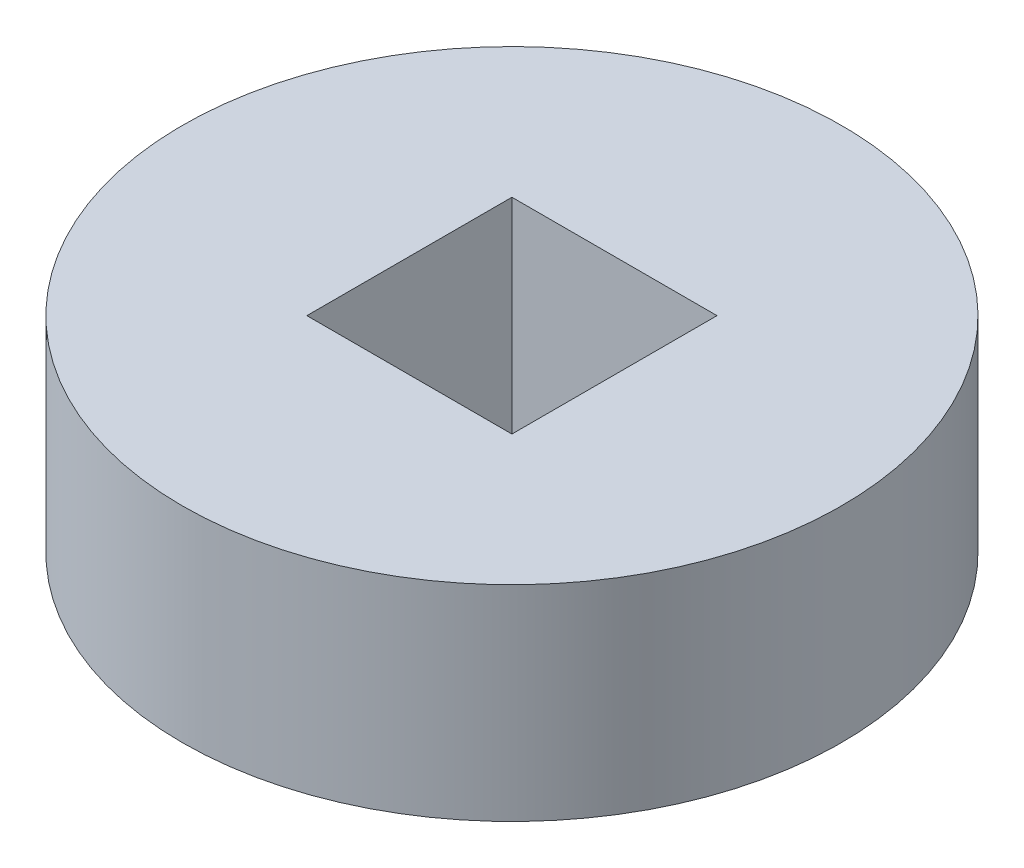
from build123d import *

# Parameters (mm, degrees)
ELEVATOR_SUPPORT_PULLEYS_R = 10.205128061
ELEVATOR_SUPPORT_PULLEYS_W = 6.35
ELEVATOR_SUPPORT_PULLEYS_H = 6.35
BOSS_EXTRUDE1_DEPTH        = 6.35


with BuildPart() as part:
    # Elevator Support Pulleys → Boss-Extrude1 (new body)
    with BuildSketch(Plane(origin=(0, 0, 0), x_dir=(1, 0, 0), z_dir=(0, 1, 0))):
        with Locations(Location((0, 0, 0), (0, 0, 270))):
            Circle(ELEVATOR_SUPPORT_PULLEYS_R)
        Rectangle(ELEVATOR_SUPPORT_PULLEYS_W, ELEVATOR_SUPPORT_PULLEYS_H, mode=Mode.SUBTRACT)
    extrude(amount=BOSS_EXTRUDE1_DEPTH)


solid = part.part
